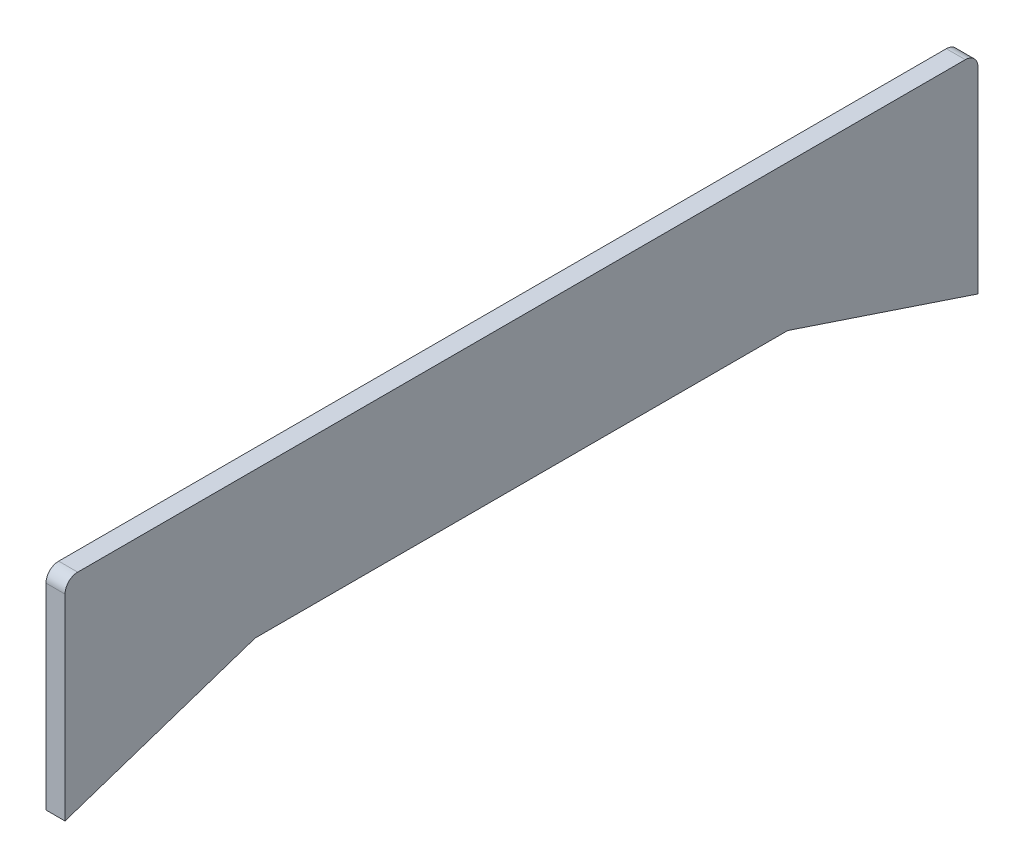
from build123d import *

# Parameters (mm, degrees)
SKETCH1_W           = 144
SKETCH1_H           = 23
BOSS_EXTRUDE1_DEPTH = 3
FILLET1_R           = 2
BOSS_EXTRUDE2_DEPTH = 3


with BuildPart() as part:
    # Sketch1 → Boss-Extrude1 (new body)
    with BuildSketch(Plane(origin=(0, 0, 0), x_dir=(0, 0, -1), z_dir=(1, 0, 0))):
        Rectangle(SKETCH1_W, SKETCH1_H)
    extrude(amount=BOSS_EXTRUDE1_DEPTH)

    # Fillet1
    fillet1_edges = [part.edges().sort_by_distance(p)[0] for p in [
        (1.5, 11.5, 72),
        (1.5, 11.5, -72),
    ]]
    fillet(fillet1_edges, radius=FILLET1_R)

    # Sketch2 → Boss-Extrude2 (add)
    with BuildSketch(Plane(origin=(3, 0, 0), x_dir=(0, 0, -1), z_dir=(1, 0, 0))):
        Polygon((-72, -11.5), (-72, -21.5), (-42, -11.5), align=None)
        Polygon((72, -11.5), (72, -21.5), (42, -11.5), align=None)
    extrude(amount=-BOSS_EXTRUDE2_DEPTH)


solid = part.part
